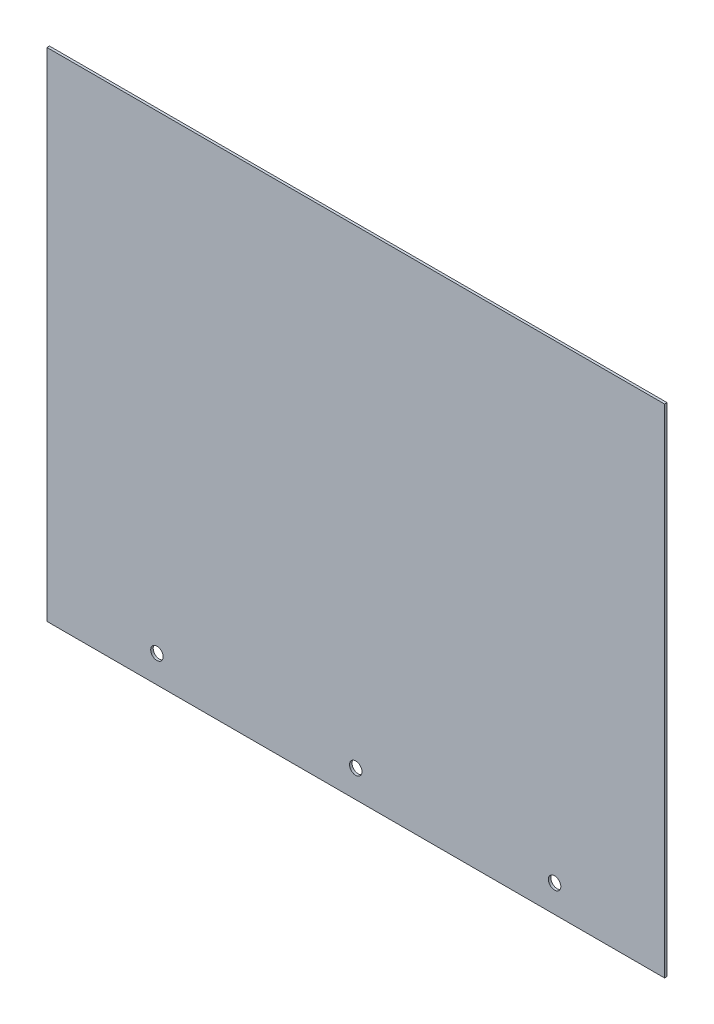
from build123d import *

# Parameters (mm, degrees)
SKETCH_1_W      = 248.5
SKETCH_1_H      = 200
SKETCH_1_R      = 2.5
EXTRUDE_1_DEPTH = 0.5


with BuildPart() as part:
    # 스케치1 → 보스-돌출1 (new, symmetric)
    with BuildSketch(Plane.XY):
        with Locations((124.25, 100)):
            Rectangle(SKETCH_1_W, SKETCH_1_H)
        with Locations((124.25, 11)):
            Circle(SKETCH_1_R, mode=Mode.SUBTRACT)
        with Locations((204.25, 11)):
            Circle(SKETCH_1_R, mode=Mode.SUBTRACT)
        with Locations((44.25, 11)):
            Circle(SKETCH_1_R, mode=Mode.SUBTRACT)
    extrude(amount=EXTRUDE_1_DEPTH, both=True)


solid = part.part
